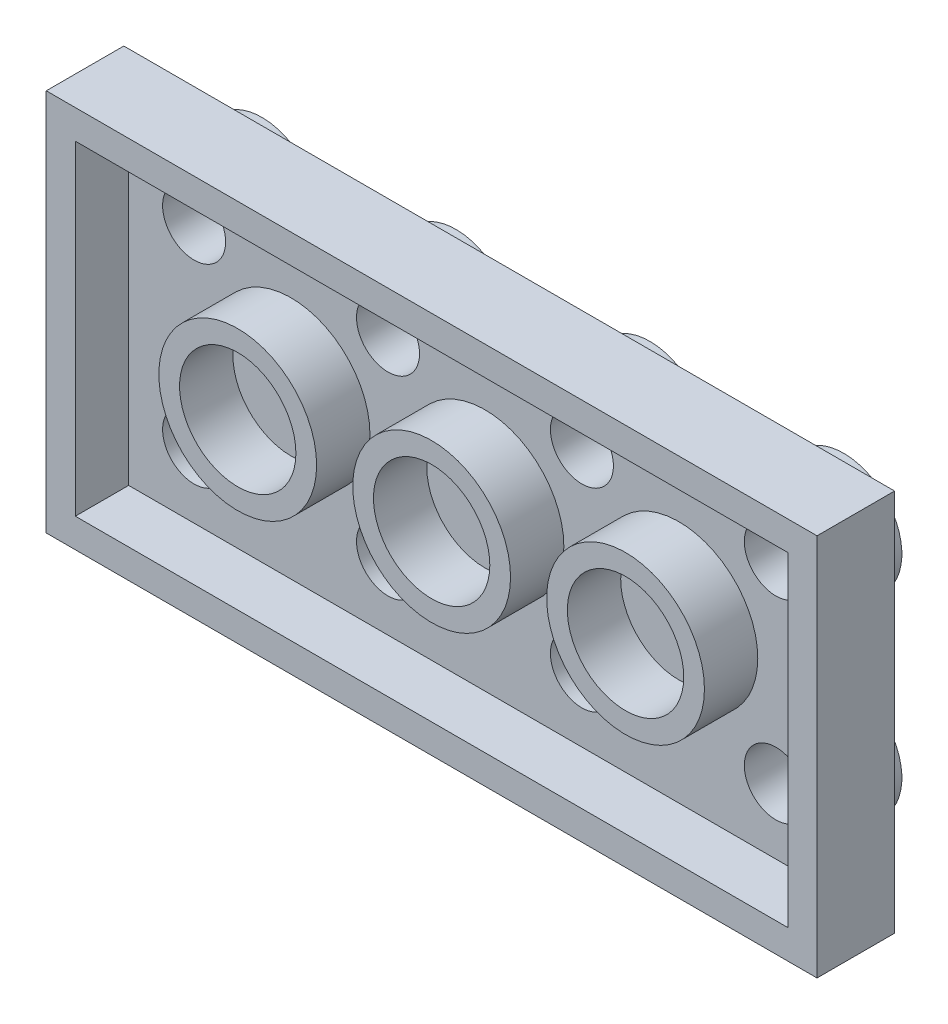
from build123d import *

# Parameters (mm, degrees)
SKETCH2_W             = 31.8
SKETCH2_H             = 15.8
SKETCH2_W_2           = 29.4
SKETCH2_H_2           = 13.4
BOSS_EXTRUDE1_DEPTH   = 3.2
SKETCH2_3_R           = 3.255
SKETCH2_3_R_2         = 2.4
BOSS_EXTRUDE2_DEPTH   = 2.2
BOSS_EXTRUDE2_2_DEPTH = 2.2
BOSS_EXTRUDE2_3_DEPTH = 2.2
SKETCH3_W             = 29.4
SKETCH3_H             = 13.4
BOSS_EXTRUDE3_DEPTH   = 1
SKETCH4_R             = 2.4
SKETCH4_R_2           = 2.399999999
BOSS_EXTRUDE4_DEPTH   = 1.8
SKETCH5_R             = 1.3
CUT_EXTRUDE1_DEPTH    = 1.8


with BuildPart() as part:
    # Sketch2 → Boss-Extrude1 (new body)
    with BuildSketch(Plane.XY):
        with Locations((15.9, -7.9)):
            Rectangle(SKETCH2_W, SKETCH2_H)
        with Locations((15.9, -7.9)):
            Rectangle(SKETCH2_W_2, SKETCH2_H_2, mode=Mode.SUBTRACT)
    extrude(amount=-BOSS_EXTRUDE1_DEPTH)



with BuildPart() as body_2:
    # Sketch2<3> → Boss-Extrude2 (new body)
    with BuildSketch(Plane.XY):
        with Locations((23.9, -7.8)):
            Circle(SKETCH2_3_R)
        with Locations((23.9, -7.8)):
            Circle(SKETCH2_3_R_2, mode=Mode.SUBTRACT)
    extrude(amount=-BOSS_EXTRUDE2_DEPTH)


with BuildPart() as body_3:
    # Sketch2<3> → Boss-Extrude2 2 (new body)
    with BuildSketch(Plane.XY):
        with Locations((15.899999998, -7.8)):
            Circle(SKETCH2_3_R)
        with Locations((15.899999998, -7.8)):
            Circle(SKETCH2_3_R_2, mode=Mode.SUBTRACT)
    extrude(amount=-BOSS_EXTRUDE2_2_DEPTH)


with BuildPart() as body_4:
    # Sketch2<3> → Boss-Extrude2 3 (new body)
    with BuildSketch(Plane.XY):
        with Locations((7.899999996, -7.8)):
            Circle(SKETCH2_3_R)
        with Locations((7.899999996, -7.8)):
            Circle(SKETCH2_3_R_2, mode=Mode.SUBTRACT)
    extrude(amount=-BOSS_EXTRUDE2_3_DEPTH)


with BuildPart() as part_1:
    add(part.part)

    add(body_2.part)  # Boss-Extrude3 merges body 2

    add(body_3.part)  # Boss-Extrude3 merges body 3

    add(body_4.part)  # Boss-Extrude3 merges body 4
    # Sketch3 → Boss-Extrude3 (add)
    with BuildSketch(Plane(origin=(0, 0, -2.2), x_dir=(-1, 0, 0), z_dir=(0, 0, -1))):
        with Locations((-15.9, -7.9)):
            Rectangle(SKETCH3_W, SKETCH3_H)
    extrude(amount=BOSS_EXTRUDE3_DEPTH)

    # Sketch4 → Boss-Extrude4 (add)
    with BuildSketch(Plane(origin=(0, 0, -3.2), x_dir=(-1, 0, 0), z_dir=(0, 0, -1))):
        with Locations((-27.9, -3.9)):
            Circle(SKETCH4_R)
        with Locations((-19.899999998, -3.9)):
            Circle(SKETCH4_R)
        with Locations((-11.899999996, -3.9)):
            Circle(SKETCH4_R)
        with Locations((-3.899999994, -3.9)):
            Circle(SKETCH4_R)
        with Locations((-19.899999998, -11.9)):
            Circle(SKETCH4_R_2)
        with Locations((-11.899999996, -11.9)):
            Circle(SKETCH4_R_2)
        with Locations((-3.899999994, -11.9)):
            Circle(SKETCH4_R_2)
        with Locations((-27.9, -11.9)):
            Circle(SKETCH4_R_2)
    extrude(amount=BOSS_EXTRUDE4_DEPTH)

    # Sketch5 → Cut-Extrude1 (cut)
    with BuildSketch(Plane.XY.offset(-2.2)):
        with Locations((3.899999994, -3.9)):
            Circle(SKETCH5_R)
        with Locations((11.899999996, -3.9)):
            Circle(SKETCH5_R)
        with Locations((19.899999998, -3.9)):
            Circle(SKETCH5_R)
        with Locations((27.9, -3.9)):
            Circle(SKETCH5_R)
        with Locations((11.899999996, -11.900000002)):
            Circle(SKETCH5_R)
        with Locations((19.899999998, -11.900000002)):
            Circle(SKETCH5_R)
        with Locations((27.9, -11.900000002)):
            Circle(SKETCH5_R)
        with Locations((3.899999994, -11.900000002)):
            Circle(SKETCH5_R)
    extrude(amount=-CUT_EXTRUDE1_DEPTH, mode=Mode.SUBTRACT)


solid = part_1.part
